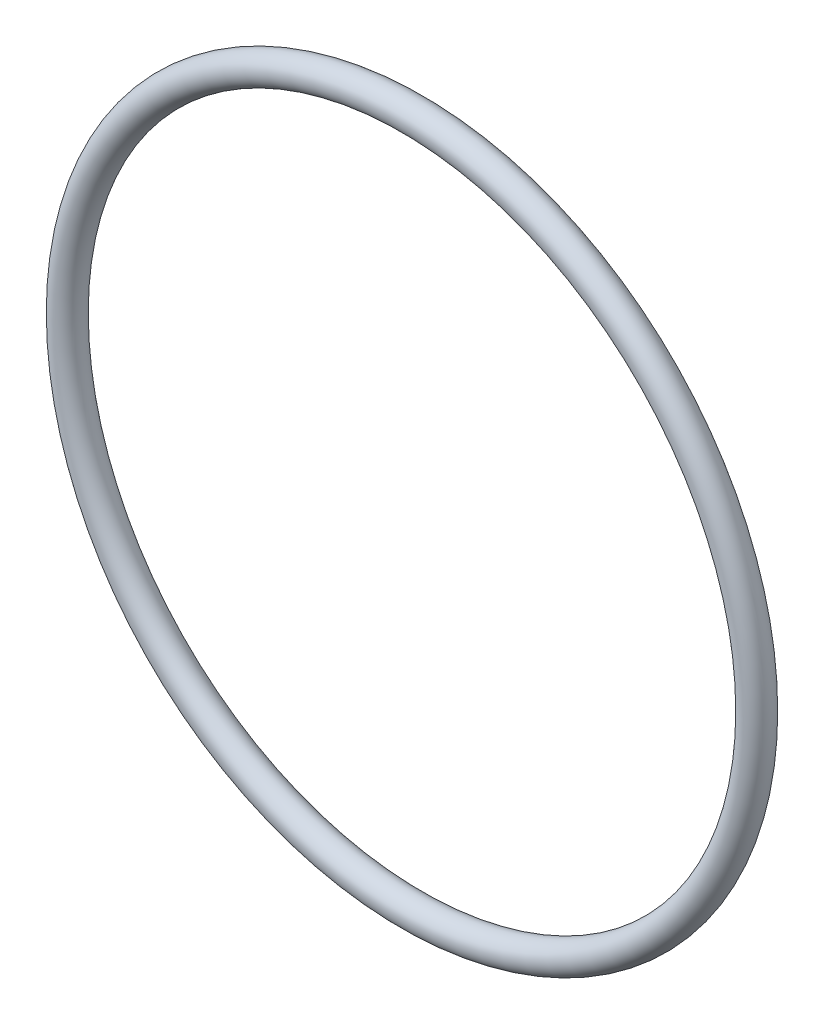
from build123d import *

# Parameters (mm, degrees)
SKETCH2_R = 0.9


with BuildPart() as part:
    # Sweep1: sweep along a path in Sketch1
    with BuildLine(Plane.XY) as sweep1_path:
        CenterArc((0, 0), 20, 0, 360)
    # Sketch2 → Sweep1 (sweep)
    with BuildSketch(Plane(origin=(0, 0, 0), x_dir=(1, 0, 0), z_dir=(0, 1, 0))):
        with Locations((-20.9, 0)):
            Circle(SKETCH2_R)
    sweep(path=sweep1_path.line)


solid = part.part
